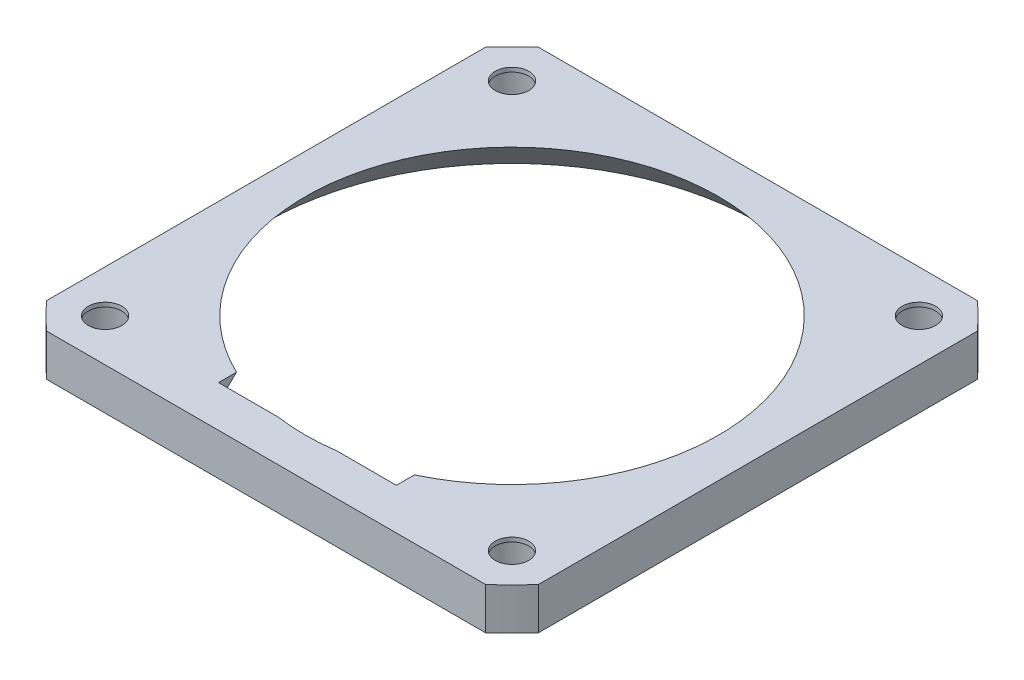
from build123d import *

# Parameters (mm, degrees)
SKETCH1_R         = 31.5
SKETCH1_R_2       = 1.6
BASE_DEPTH        = 4
SKETCH3_R         = 23.5
SKETCH4_R         = 19.75054858
CONNECTORS_DEPTH  = 45.72694938
SKETCH5_R         = 3
SCREW_HEADS_DEPTH = 3.6
FLEX_CABLE_DEPTH  = 34.473870559


with BuildPart() as part:
    # Sketch1 → Base (new body)
    with BuildSketch(Plane(origin=(0, 0, 0), x_dir=(1, 0, 0), z_dir=(0, 1, 0))):
        with Locations(Location((0, 0, 0), (0, 0, 270))):
            Circle(SKETCH1_R)
        with Locations(Location((-19.445436483, -19.445436483, 0), (0, 0, 270))):
            Circle(SKETCH1_R_2, mode=Mode.SUBTRACT)
        with Locations(Location((-19.445436483, 19.445436483, 0), (0, 0, 270))):
            Circle(SKETCH1_R_2, mode=Mode.SUBTRACT)
        with Locations(Location((19.445436483, -19.445436483, 0), (0, 0, 270))):
            Circle(SKETCH1_R_2, mode=Mode.SUBTRACT)
        with Locations(Location((19.445436483, 19.445436483, 0), (0, 0, 270))):
            Circle(SKETCH1_R_2, mode=Mode.SUBTRACT)
    extrude(amount=-BASE_DEPTH)

    # Sketch3 → Skirt section 0
    with BuildSketch(Plane(origin=(0, -4, 0), x_dir=(-1, 0, 0), z_dir=(0, -1, 0))):
        Circle(SKETCH3_R)
    # Sketch4 → Skirt section 1
    with BuildSketch(Plane(origin=(0, 0, 0), x_dir=(1, 0, 0), z_dir=(0, 1, 0))):
        Circle(SKETCH4_R)
    loft(mode=Mode.SUBTRACT)

    # Sketch6 → Connectors (cut, through all)
    with BuildSketch(Plane(origin=(0, -4, 0), x_dir=(-1, 0, 0), z_dir=(0, -1, 0))):
        with BuildLine():
            Line((20.976176963, 23.5), (-20.976176963, 23.5))
            ThreePointArc((-20.976176963, 23.5), (0, 31.5), (20.976176963, 23.5))
        make_face()
        with BuildLine():
            Line((20.976176963, -23.5), (-20.976176963, -23.5))
            ThreePointArc((-20.976176963, -23.5), (0, -31.5), (20.976176963, -23.5))
        make_face()
        with BuildLine():
            Line((23.5, -20.976176963), (23.5, 20.976176963))
            ThreePointArc((23.5, 20.976176963), (31.5, 0), (23.5, -20.976176963))
        make_face()
        with BuildLine():
            Line((-23.5, -20.976176963), (-23.5, 20.976176963))
            ThreePointArc((-23.5, 20.976176963), (-31.5, 0), (-23.5, -20.976176963))
        make_face()
    extrude(amount=-CONNECTORS_DEPTH, mode=Mode.SUBTRACT)

    # Sketch5 → Screw heads (cut)
    with BuildSketch(Plane(origin=(0, -4, 0), x_dir=(-1, 0, 0), z_dir=(0, -1, 0))):
        with Locations(Location((19.445436483, -19.445436483, 0), (0, 0, 90))):
            Circle(SKETCH5_R)
        with Locations(Location((19.445436483, 19.445436483, 0), (0, 0, 90))):
            Circle(SKETCH5_R)
        with Locations(Location((-19.445436483, -19.445436483, 0), (0, 0, 90))):
            Circle(SKETCH5_R)
        with Locations(Location((-19.445436483, 19.445436483, 0), (0, 0, 90))):
            Circle(SKETCH5_R)
    extrude(amount=-SCREW_HEADS_DEPTH, mode=Mode.SUBTRACT)

    # Sketch7 → Flex cable (cut, through all)
    with BuildSketch(Plane(origin=(0, 0, 0), x_dir=(1, 0, 0), z_dir=(0, 1, 0))):
        Polygon((-8.5, -19.55054858), (8.5, -19.55054858), (8.5, -18.75054858), (8.5, 0), (0, 0), (-8.5, 0), (-8.5, -18.75054858), align=None)
    extrude(amount=-FLEX_CABLE_DEPTH, mode=Mode.SUBTRACT)


solid = part.part
